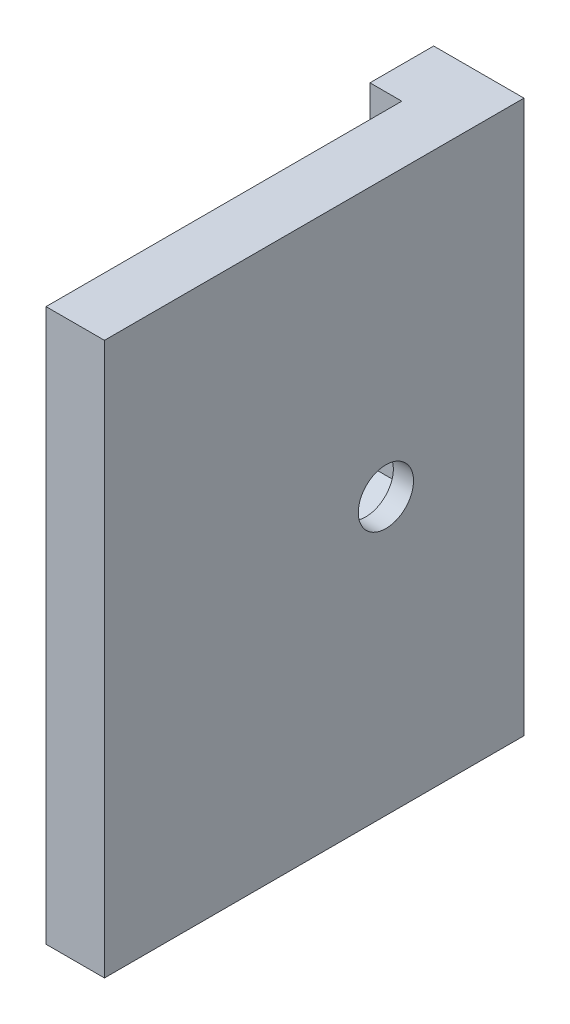
from build123d import *

# Parameters (mm, degrees)
SKETCH1_W           = 39.5
SKETCH1_H           = 52
SKETCH1_R           = 2.6
BOSS_EXTRUDE1_DEPTH = 5.5
CUT_EXTRUDE1_DEPTH  = 3.6
SKETCH3_W           = 8.5
SKETCH3_H           = 52
BOSS_EXTRUDE2_DEPTH = 6
SKETCH4_R           = 5.05
SKETCH4_R_2         = 1.7
BOSS_EXTRUDE3_DEPTH = 6
SKETCH5_R           = 5.05
SKETCH5_R_2         = 1.7
BOSS_EXTRUDE4_DEPTH = 6
SKETCH6_R           = 1.7
CUT_EXTRUDE2_DEPTH  = 6


with BuildPart() as part:
    # Sketch1 → Boss-Extrude1 (new body)
    with BuildSketch(Plane(origin=(330.5, 0, 0), x_dir=(0, 0, -1), z_dir=(1, 0, 0))):
        with Locations((-306.75, 300)):
            Rectangle(SKETCH1_W, SKETCH1_H)
        with Locations((-300, 300)):
            Circle(SKETCH1_R, mode=Mode.SUBTRACT)
    extrude(amount=BOSS_EXTRUDE1_DEPTH)

    # Sketch2 → Cut-Extrude1 (cut)
    with BuildSketch(Plane(origin=(330.5, 0, 0), x_dir=(0, 0, -1), z_dir=(1, 0, 0))):
        Polygon((-304.1, 302.367136104), (-300, 304.734272207), (-295.9, 302.367136104), (-295.9, 297.632863896), (-300, 295.265727793), (-304.1, 297.632863896), align=None)
    extrude(amount=CUT_EXTRUDE1_DEPTH, mode=Mode.SUBTRACT)

    # Sketch3 → Boss-Extrude2 (add)
    with BuildSketch(Plane.XY.offset(287)):
        with Locations((331.75, 300)):
            Rectangle(SKETCH3_W, SKETCH3_H)
    extrude(amount=BOSS_EXTRUDE2_DEPTH)

    # Sketch4 → Boss-Extrude3 (add)
    with BuildSketch(Plane.XY.offset(287)):
        with Locations((329.3, 283)):
            Circle(SKETCH4_R)
        with Locations((329.3, 283)):
            Circle(SKETCH4_R_2, mode=Mode.SUBTRACT)
    extrude(amount=BOSS_EXTRUDE3_DEPTH)

    # Sketch5 → Boss-Extrude4 (add)
    with BuildSketch(Plane.XY.offset(287)):
        with Locations((329.3, 317)):
            Circle(SKETCH5_R)
        with Locations((329.3, 317)):
            Circle(SKETCH5_R_2, mode=Mode.SUBTRACT)
    extrude(amount=BOSS_EXTRUDE4_DEPTH)

    # Sketch6 → Cut-Extrude2 (cut)
    with BuildSketch(Plane.XY.offset(287)):
        with Locations(Location((329.3, 283, 0), (0, 0, 314.900872156))):
            Circle(SKETCH6_R)
        with Locations(Location((329.3, 317, 0), (0, 0, 314.900872156))):
            Circle(SKETCH6_R)
    extrude(amount=CUT_EXTRUDE2_DEPTH, mode=Mode.SUBTRACT)


solid = part.part
